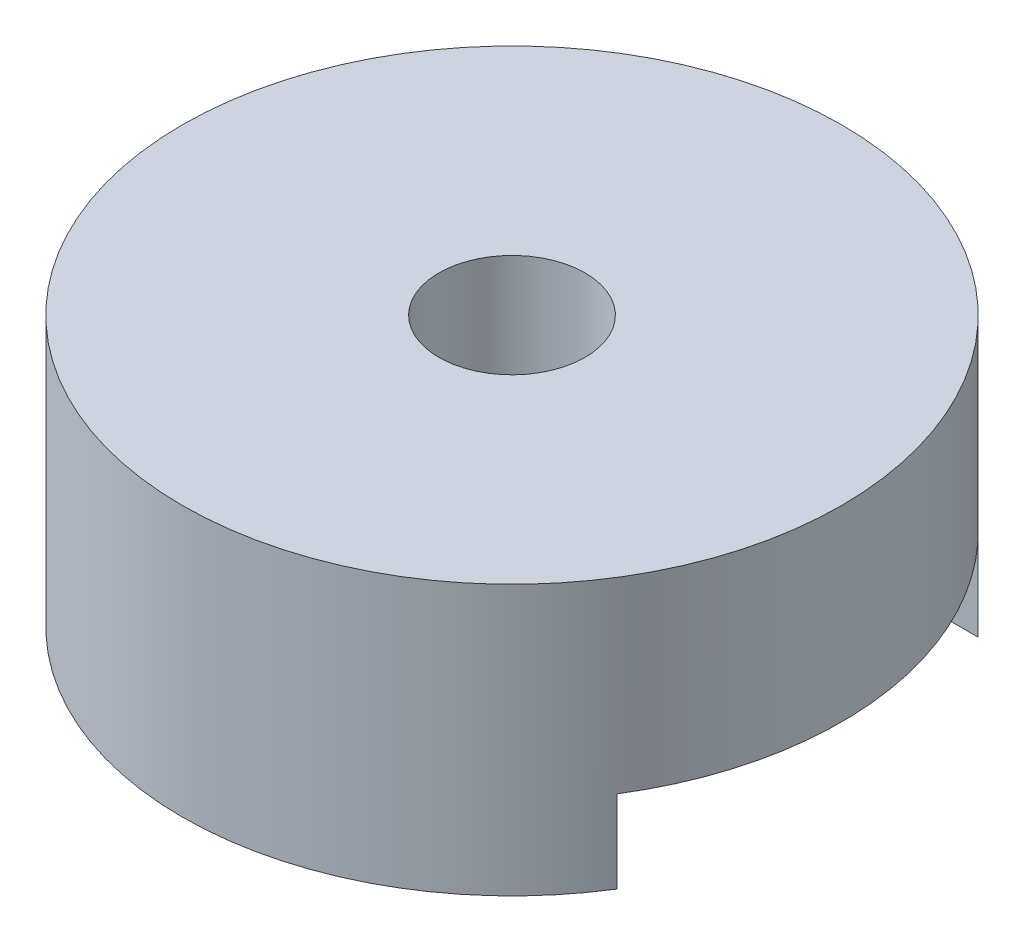
from build123d import *

# Parameters (mm, degrees)
SKETCH1_W           = 15.8
SKETCH1_H           = 16.15
SKETCH1_W_2         = 12.2
SKETCH1_H_2         = 12.55
BOSS_EXTRUDE1_DEPTH = 3
SKETCH1_3_W         = 15.8
SKETCH1_3_H         = 16.15
BOSS_EXTRUDE2_DEPTH = 5
BOSS_EXTRUDE3_DEPTH = 6.6
BOSS_EXTRUDE4_START = 6.5
SKETCH1_5_R         = 16
SKETCH1_5_R_2       = 3.55
BOSS_EXTRUDE4_DEPTH = 6.5
SKETCH2_R           = 1.225
CUT_EXTRUDE1_DEPTH  = 12
CUT_EXTRUDE2_START  = -4.6
CUT_EXTRUDE2_DEPTH  = 4.6
CUT_EXTRUDE3_START  = -4
CUT_EXTRUDE3_DEPTH  = 4
SKETCH5_R           = 0.5
CUT_EXTRUDE4_DEPTH  = 0.4


with BuildPart() as part:
    # Sketch1 → Boss-Extrude1 (new body)
    with BuildSketch(Plane(origin=(0, 0, 0), x_dir=(1, 0, 0), z_dir=(0, 1, 0))):
        Rectangle(SKETCH1_W, SKETCH1_H)
        Rectangle(SKETCH1_W_2, SKETCH1_H_2, mode=Mode.SUBTRACT)
    extrude(amount=-BOSS_EXTRUDE1_DEPTH)

    # Sketch1<3> → Boss-Extrude2 (add)
    with BuildSketch(Plane(origin=(0, 0, 0), x_dir=(1, 0, 0), z_dir=(0, 1, 0))):
        with BuildLine():
            Line((10.7, 10.875), (-11.736028928, 10.875))
            ThreePointArc((-11.736028928, 10.875), (-15.928532305, 1.510582208), (-13.571085992, -8.475))
            Line((-13.571085992, -8.475), (10.7, -8.475))
            Line((10.7, -8.475), (10.7, 10.875))
        make_face()
        Rectangle(SKETCH1_3_W, SKETCH1_3_H, mode=Mode.SUBTRACT)
    extrude(amount=-BOSS_EXTRUDE2_DEPTH)

    # Sketch1<4> → Boss-Extrude3 (add)
    with BuildSketch(Plane(origin=(0, 0, 0), x_dir=(1, 0, 0), z_dir=(0, 1, 0))):
        with BuildLine():
            ThreePointArc((16, 0), (5.840528108, 14.895913246), (-11.736028928, 10.875))
            Line((-11.736028928, 10.875), (10.7, 10.875))
            Line((10.7, 10.875), (10.7, -8.475))
            Line((10.7, -8.475), (-13.571085992, -8.475))
            ThreePointArc((-13.571085992, -8.475), (4.408096195, -15.380789575), (16, 0))
        make_face()
    extrude(amount=-BOSS_EXTRUDE3_DEPTH)

    # Sketch1<5> → Boss-Extrude4 (add)
    with BuildSketch(Plane(origin=(0, 0, 0), x_dir=(1, 0, 0), z_dir=(0, 1, 0)).offset(BOSS_EXTRUDE4_START)):
        with Locations(Location((0, 0, 0), (0, 0, 270))):
            Circle(SKETCH1_5_R)
        with Locations(Location((0, 0, 0), (0, 0, 90))):
            Circle(SKETCH1_5_R_2, mode=Mode.SUBTRACT)
    extrude(amount=-BOSS_EXTRUDE4_DEPTH)

    # Sketch2 → Cut-Extrude1 (cut)
    with BuildSketch(Plane.XZ.offset(6.6)):
        with Locations(Location((0, 14, 0), (0, 0, 270))):
            Circle(SKETCH2_R)
        with Locations(Location((0, -14, 0), (0, 0, 270))):
            Circle(SKETCH2_R)
    extrude(amount=-CUT_EXTRUDE1_DEPTH, mode=Mode.SUBTRACT)

    # Sketch3 → Cut-Extrude2 (cut)
    with BuildSketch(Plane.XZ.offset(6.6).offset(CUT_EXTRUDE2_START)):
        with BuildLine():
            Line((-11.736028928, -10.875), (-11.736028928, 10.875))
            ThreePointArc((-11.736028928, 10.875), (-12.710331089, 9.71840952), (-13.571085992, 8.475))
            ThreePointArc((-13.571085992, 8.475), (-15.928532305, -1.510582208), (-11.736028928, -10.875))
        make_face()
    extrude(amount=CUT_EXTRUDE2_DEPTH, mode=Mode.SUBTRACT)

    # Sketch4 → Cut-Extrude3 (cut)
    with BuildSketch(Plane.XZ.offset(6.6).offset(CUT_EXTRUDE3_START)):
        with BuildLine():
            Line((10.7, 8.475), (13.571085992, 8.475))
            ThreePointArc((13.571085992, 8.475), (15.928532305, -1.510582208), (11.736028928, -10.875))
            Line((11.736028928, -10.875), (10.7, -10.875))
            Line((10.7, -10.875), (10.7, 8.475))
        make_face()
    extrude(amount=CUT_EXTRUDE3_DEPTH, mode=Mode.SUBTRACT)

    # Sketch5 → Cut-Extrude4 (cut)
    with BuildSketch(Plane.XZ.offset(2)):
        with Locations(Location((-13.736028928, 5.041127606, 0), (0, 0, 270))):
            Circle(SKETCH5_R)
        with Locations(Location((-13.736028928, 2.501127606, 0), (0, 0, 270))):
            Circle(SKETCH5_R)
        with Locations(Location((-13.736028928, -0.038872394, 0), (0, 0, 270))):
            Circle(SKETCH5_R)
        with Locations(Location((-13.736028928, -2.578872394, 0), (0, 0, 270))):
            Circle(SKETCH5_R)
        with Locations(Location((-13.736028928, -5.118872394, 0), (0, 0, 270))):
            Circle(SKETCH5_R)
    extrude(amount=-CUT_EXTRUDE4_DEPTH, mode=Mode.SUBTRACT)


solid = part.part
